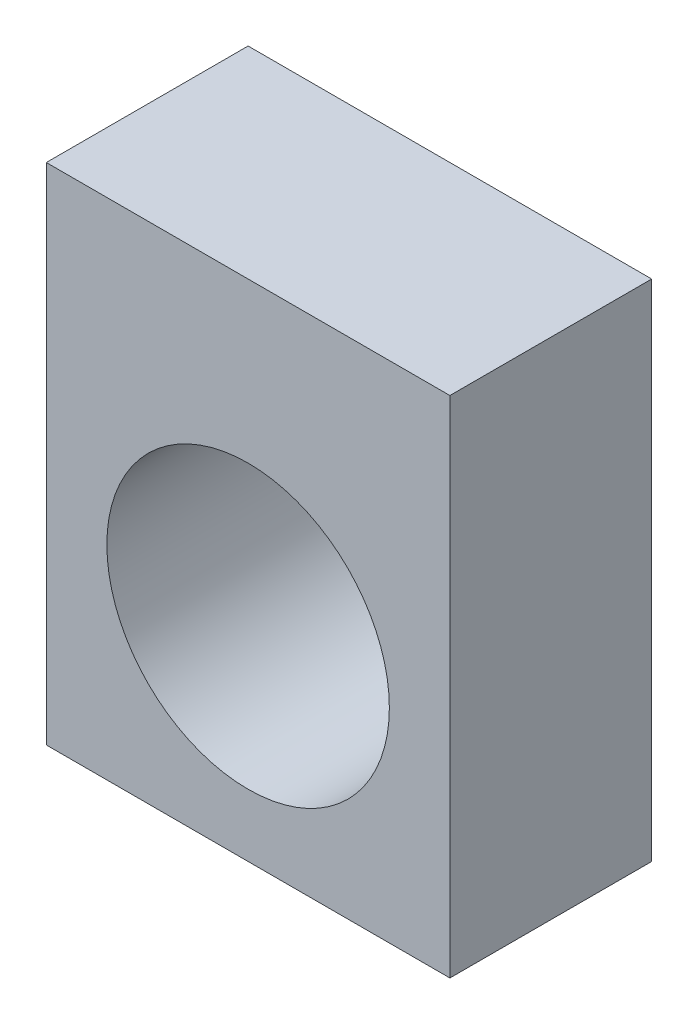
from build123d import *

# Parameters (mm, degrees)
ESQUISSE1_W             = 20
ESQUISSE1_H             = 25
BOSS_EXTRU_1_DEPTH      = 10
ESQUISSE2_R             = 7
ENL_V_MAT_EXTRU_1_DEPTH = 34.541019662


with BuildPart() as part:
    # Esquisse1 → Boss.-Extru.1 (new body)
    with BuildSketch(Plane.XY):
        with Locations((10, 12.5)):
            Rectangle(ESQUISSE1_W, ESQUISSE1_H)
    extrude(amount=BOSS_EXTRU_1_DEPTH)

    # Esquisse2 → Enlèv. mat.-Extru.1 (cut, through all)
    with BuildSketch(Plane.XY.offset(10)):
        with Locations((10, 10.1)):
            Circle(ESQUISSE2_R)
    extrude(amount=-ENL_V_MAT_EXTRU_1_DEPTH, mode=Mode.SUBTRACT)


solid = part.part
